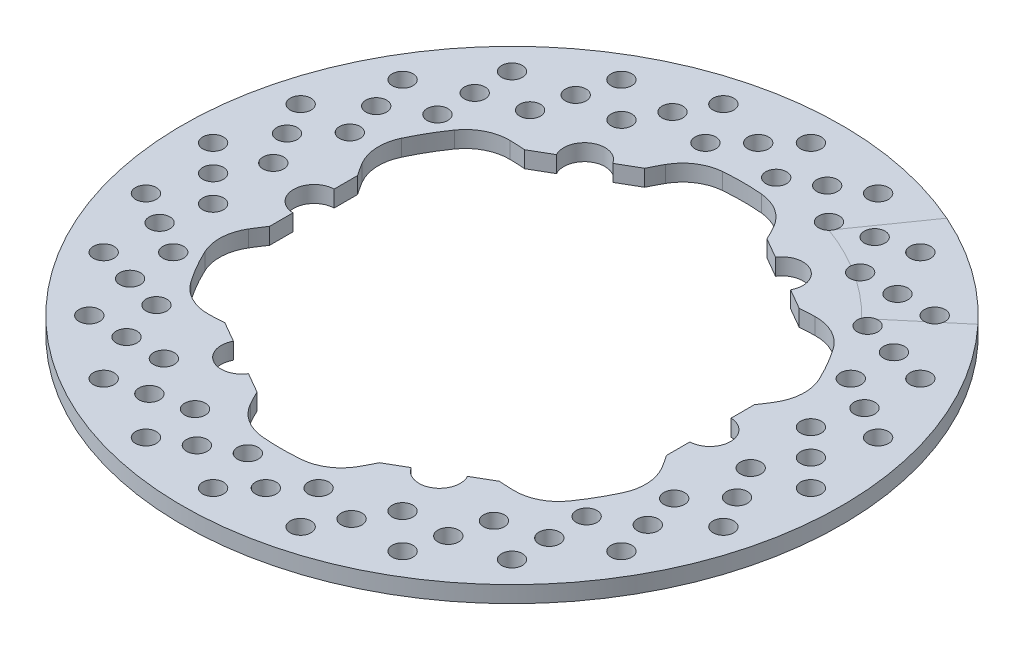
from build123d import *

# Parameters (mm, degrees)
SKETCH1_R                = 95.25
SKETCH1_R_2              = 66.675
BOSS_EXTRUDE2_DEPTH      = 2.38125
SKETCH2_R                = 3
CUT_EXTRUDE1_DEPTH       = 135.788005424
BOSS_EXTRUDE3_DEPTH      = 2.38125
FILLET1_R                = 12.7
CIRPATTERN1_COUNT        = 6
FILLET1_OF_CIRPATTERN1_R = 12.7


with BuildPart() as part:
    # Sketch1 → Boss-Extrude2 (new, symmetric)
    with BuildSketch(Plane(origin=(0, 0, 0), x_dir=(1, 0, 0), z_dir=(0, 1, 0))):
        Circle(SKETCH1_R)
        Circle(SKETCH1_R_2, mode=Mode.SUBTRACT)
    extrude(amount=BOSS_EXTRUDE2_DEPTH, both=True)

    # Sketch2 → Cut-Extrude1 (cut, through all)
    with BuildSketch(Plane.XZ.offset(2.38125)):
        with Locations((0, 86.36)):
            Circle(SKETCH2_R)
        with Locations((7.62, 78.74)):
            Circle(SKETCH2_R)
        with Locations((15.24, 71.12)):
            Circle(SKETCH2_R)
        with Locations((27.739766408, 74.084798438)):
            Circle(SKETCH2_R)
        with Locations((33.12792008, 64.752242518)):
            Circle(SKETCH2_R)
        with Locations((22.351612735, 83.417354358)):
            Circle(SKETCH2_R)
        with Locations((45.969113577, 64.380840294)):
            Circle(SKETCH2_R)
        with Locations((48.758227154, 53.971726717)):
            Circle(SKETCH2_R)
        with Locations((43.18, 74.789953871)):
            Circle(SKETCH2_R)
        with Locations((61.065741623, 50.289434278)):
            Circle(SKETCH2_R)
        with Locations((61.065741623, 39.513126933)):
            Circle(SKETCH2_R)
        with Locations((61.065741623, 61.065741623)):
            Circle(SKETCH2_R)
        with Locations((72.000840294, 32.770886423)):
            Circle(SKETCH2_R)
        with Locations((69.211726717, 22.361772846)):
            Circle(SKETCH2_R)
        with Locations((74.789953871, 43.18)):
            Circle(SKETCH2_R)
        with Locations((78.029200686, 13.019056815)):
            Circle(SKETCH2_R)
        with Locations((72.641047013, 3.686500895)):
            Circle(SKETCH2_R)
        with Locations((83.417354358, 22.351612735)):
            Circle(SKETCH2_R)
        with Locations((78.74, -7.62)):
            Circle(SKETCH2_R)
        with Locations((71.12, -15.24)):
            Circle(SKETCH2_R)
        with Locations((86.36, 0)):
            Circle(SKETCH2_R)
        with Locations((74.084798438, -27.739766408)):
            Circle(SKETCH2_R)
        with Locations((64.752242518, -33.12792008)):
            Circle(SKETCH2_R)
        with Locations((83.417354358, -22.351612735)):
            Circle(SKETCH2_R)
        with Locations((64.380840294, -45.969113577)):
            Circle(SKETCH2_R)
        with Locations((53.971726717, -48.758227154)):
            Circle(SKETCH2_R)
        with Locations((74.789953871, -43.18)):
            Circle(SKETCH2_R)
        with Locations((50.289434278, -61.065741623)):
            Circle(SKETCH2_R)
        with Locations((39.513126933, -61.065741623)):
            Circle(SKETCH2_R)
        with Locations((61.065741623, -61.065741623)):
            Circle(SKETCH2_R)
        with Locations((32.770886423, -72.000840294)):
            Circle(SKETCH2_R)
        with Locations((22.361772846, -69.211726717)):
            Circle(SKETCH2_R)
        with Locations((43.18, -74.789953871)):
            Circle(SKETCH2_R)
        with Locations((13.019056815, -78.029200686)):
            Circle(SKETCH2_R)
        with Locations((3.686500895, -72.641047013)):
            Circle(SKETCH2_R)
        with Locations((22.351612735, -83.417354358)):
            Circle(SKETCH2_R)
        with Locations((-7.62, -78.74)):
            Circle(SKETCH2_R)
        with Locations((-15.24, -71.12)):
            Circle(SKETCH2_R)
        with Locations((0, -86.36)):
            Circle(SKETCH2_R)
        with Locations((-27.739766408, -74.084798438)):
            Circle(SKETCH2_R)
        with Locations((-33.12792008, -64.752242518)):
            Circle(SKETCH2_R)
        with Locations((-22.351612735, -83.417354358)):
            Circle(SKETCH2_R)
        with Locations((-45.969113577, -64.380840294)):
            Circle(SKETCH2_R)
        with Locations((-48.758227154, -53.971726717)):
            Circle(SKETCH2_R)
        with Locations((-43.18, -74.789953871)):
            Circle(SKETCH2_R)
        with Locations((-61.065741623, -50.289434278)):
            Circle(SKETCH2_R)
        with Locations((-61.065741623, -39.513126933)):
            Circle(SKETCH2_R)
        with Locations((-61.065741623, -61.065741623)):
            Circle(SKETCH2_R)
        with Locations((-72.000840294, -32.770886423)):
            Circle(SKETCH2_R)
        with Locations((-69.211726717, -22.361772846)):
            Circle(SKETCH2_R)
        with Locations((-74.789953871, -43.18)):
            Circle(SKETCH2_R)
        with Locations((-78.029200686, -13.019056815)):
            Circle(SKETCH2_R)
        with Locations((-72.641047013, -3.686500895)):
            Circle(SKETCH2_R)
        with Locations((-83.417354358, -22.351612735)):
            Circle(SKETCH2_R)
        with Locations((-78.74, 7.62)):
            Circle(SKETCH2_R)
        with Locations((-71.12, 15.24)):
            Circle(SKETCH2_R)
        with Locations((-86.36, 0)):
            Circle(SKETCH2_R)
        with Locations((-74.084798438, 27.739766408)):
            Circle(SKETCH2_R)
        with Locations((-64.752242518, 33.12792008)):
            Circle(SKETCH2_R)
        with Locations((-83.417354358, 22.351612735)):
            Circle(SKETCH2_R)
        with Locations((-64.380840294, 45.969113577)):
            Circle(SKETCH2_R)
        with Locations((-53.971726717, 48.758227154)):
            Circle(SKETCH2_R)
        with Locations((-74.789953871, 43.18)):
            Circle(SKETCH2_R)
        with Locations((-50.289434278, 61.065741623)):
            Circle(SKETCH2_R)
        with Locations((-39.513126933, 61.065741623)):
            Circle(SKETCH2_R)
        with Locations((-61.065741623, 61.065741623)):
            Circle(SKETCH2_R)
        with Locations((-32.770886423, 72.000840294)):
            Circle(SKETCH2_R)
        with Locations((-22.361772846, 69.211726717)):
            Circle(SKETCH2_R)
        with Locations((-43.18, 74.789953871)):
            Circle(SKETCH2_R)
        with Locations((-13.019056815, 78.029200686)):
            Circle(SKETCH2_R)
        with Locations((-3.686500895, 72.641047013)):
            Circle(SKETCH2_R)
        with Locations((-22.351612735, 83.417354358)):
            Circle(SKETCH2_R)
    extrude(amount=-CUT_EXTRUDE1_DEPTH, mode=Mode.SUBTRACT)

    # Sketch3 → Boss-Extrude3 (add, symmetric)
    with BuildSketch(Plane(origin=(0, 0, 0), x_dir=(1, 0, 0), z_dir=(0, 1, 0))):
        with BuildLine():
            Line((-57.3278, 5.950469261), (-57.3278, 12.7))
            ThreePointArc((-57.3278, 12.7), (-60.279492249, 17.355192349), (-62.861792847, 22.225))
            ThreePointArc((-62.861792847, 22.225), (-66.675, 0), (-62.861792847, -22.225))
            ThreePointArc((-62.861792847, -22.225), (-60.279492249, -17.355192349), (-57.3278, -12.7))
            Line((-57.3278, -12.7), (-57.3278, -5.950469261))
            ThreePointArc((-57.3278, -5.950469261), (-63.103125, 0), (-57.3278, 5.950469261))
        make_face()
    boss_extrude3 = extrude(amount=BOSS_EXTRUDE3_DEPTH, both=True)

    # Fillet1
    fillet1_edges = [part.edges().sort_by_distance(p)[0] for p in [
        (-62.861792847, 0, 22.225),
        (-62.861792847, 0, -22.225),
    ]]
    fillet(fillet1_edges, radius=FILLET1_R)

    # CirPattern1: Boss-Extrude3 ×6 about axis
    cirpattern1_axis = Axis((0, 83.345574676, 0), (0, -1, 0))
    for i in range(1, CIRPATTERN1_COUNT):
        add(boss_extrude3.rotate(cirpattern1_axis, i * 360 / CIRPATTERN1_COUNT))

    # Fillet1 of CirPattern1
    fillet1_of_cirpattern1_edges = [part.edges().sort_by_distance(p)[0] for p in [
        (-50.678311023, 0, -43.327409533),
        (-12.183481825, 0, -65.552409533),
        (12.183481825, 0, -65.552409533),
        (50.678311023, 0, -43.327409533),
        (62.861792847, 0, -22.225),
        (62.861792847, 0, 22.225),
        (50.678311023, 0, 43.327409533),
        (12.183481825, 0, 65.552409533),
        (-12.183481825, 0, 65.552409533),
        (-50.678311023, 0, 43.327409533),
    ]]
    fillet(fillet1_of_cirpattern1_edges, radius=FILLET1_OF_CIRPATTERN1_R)


solid = part.part
